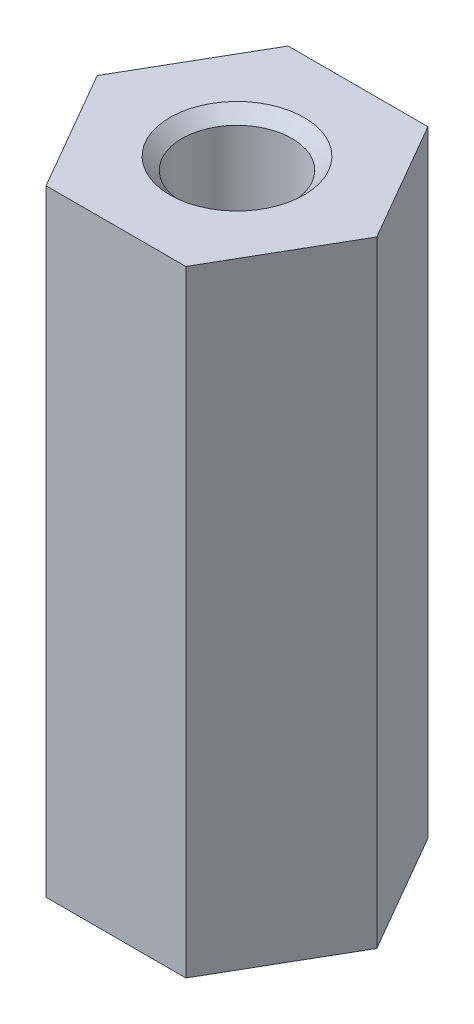
from build123d import *

# Parameters (mm, degrees)
AUFSATZ_LINEAR_AUSTRAGEN1_DEPTH = 14
M3_GEWINDEBOHRUNG1_D            = 2.5
M3_GEWINDEBOHRUNG1_CSINK_D      = 3.05
M3_GEWINDEBOHRUNG1_CSINK_ANGLE  = 90


with BuildPart() as part:
    # Skizze1 → Aufsatz-Linear austragen1 (new body)
    with BuildSketch(Plane(origin=(0, 0, 0), x_dir=(1, 0, 0), z_dir=(0, 1, 0))):
        Polygon((3.175426481, 0), (1.58771324, 2.75), (-1.58771324, 2.75), (-3.175426481, 0), (-1.58771324, -2.75), (1.58771324, -2.75), align=None)
    extrude(amount=AUFSATZ_LINEAR_AUSTRAGEN1_DEPTH)

    # M3 Gewindebohrung1 (through all)
    with Locations(Plane(origin=(0, 14, 0), x_dir=(1, 0, 0), z_dir=(0, 1, 0))):
        with Locations((0, 0)):
            CounterSinkHole(M3_GEWINDEBOHRUNG1_D / 2, M3_GEWINDEBOHRUNG1_CSINK_D / 2, counter_sink_angle=M3_GEWINDEBOHRUNG1_CSINK_ANGLE)


solid = part.part
